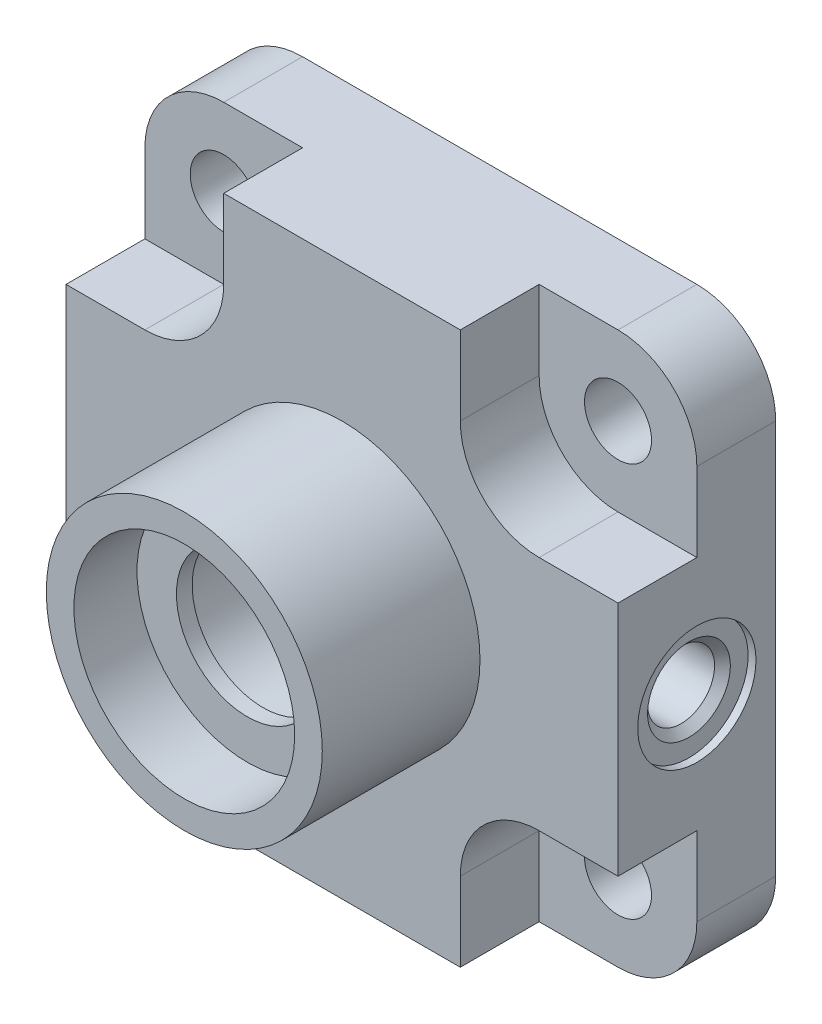
from build123d import *

# Parameters (mm, degrees)
SKETCH2_W               = 70
SKETCH2_H               = 70
BOSS_EXTRUDE1_DEPTH     = 24
SKETCH3_R               = 55
SKETCH3_W               = 70
SKETCH3_H               = 70
SKETCH3_R_2             = 22
SKETCH3_R_3             = 16
CUT_EXTRUDE1_DEPTH      = 4
SKETCH3_3_W             = 70
SKETCH3_3_H             = 70
SKETCH3_3_R             = 25
CUT_EXTRUDE2_DEPTH      = 4
SKETCH4_W               = 20
SKETCH4_H               = 20
SKETCH4_R               = 4.25
CUT_EXTRUDE3_DEPTH      = 10
CUT_EXTRUDE4_REACH      = 57.009
SKETCH4_3_R             = 4.25
MIRROR2_COPY_1_SKETCH_W = 20
MIRROR2_COPY_1_SKETCH_H = 20
MIRROR2_COPY_1_SKETCH_R = 4.25
MIRROR2_COPY_1_DEPTH    = 10
MIRROR2_COPY_2_REACH    = 57.009
MIRROR2_COPY_2_SKETCH_R = 4.25
FILLET1_R               = 10
SKETCH5_R               = 17.5
BOSS_EXTRUDE2_DEPTH     = 20
SKETCH6_R               = 14
CUT_EXTRUDE5_DEPTH      = 8
SKETCH7_R               = 9
CUT_EXTRUDE6_DEPTH      = 2
SKETCH8_R               = 10
CUT_EXTRUDE7_DEPTH      = 10
SKETCH9_R               = 9
CUT_EXTRUDE8_DEPTH      = 4
SKETCH10_R              = 10
CUT_EXTRUDE9_DEPTH      = 20
SKETCH11_R              = 7.5
CUT_EXTRUDE10_DEPTH     = 1
M10_TAPPED_HOLE1_REACH  = 91.006
M10_TAPPED_HOLE1_BORE_R = 4.25
CHAMFER1_SIZE           = 1


with BuildPart() as part:
    # Sketch2 → Boss-Extrude1 (new body)
    with BuildSketch(Plane.XY):
        Rectangle(SKETCH2_W, SKETCH2_H)
    extrude(amount=BOSS_EXTRUDE1_DEPTH)

    # Sketch3 → Cut-Extrude1 (cut)
    # profile 1 of 2: a face of its own
    with BuildSketch(Plane(origin=(0, 0, 0), x_dir=(-1, 0, 0), z_dir=(0, 0, -1))):
        Circle(SKETCH3_R)
        Rectangle(SKETCH3_W, SKETCH3_H, mode=Mode.SUBTRACT)
    # profile 2 of 2: a face of its own
    with BuildSketch(Plane(origin=(0, 0, 0), x_dir=(-1, 0, 0), z_dir=(0, 0, -1))):
        Circle(SKETCH3_R_2)
        Circle(SKETCH3_R_3, mode=Mode.SUBTRACT)
    extrude(amount=-CUT_EXTRUDE1_DEPTH, mode=Mode.SUBTRACT)

    # Sketch3<3> → Cut-Extrude2 (cut)
    with BuildSketch(Plane(origin=(0, 0, 0), x_dir=(-1, 0, 0), z_dir=(0, 0, -1))):
        Rectangle(SKETCH3_3_W, SKETCH3_3_H)
        Circle(SKETCH3_3_R, mode=Mode.SUBTRACT)
    extrude(amount=-CUT_EXTRUDE2_DEPTH, mode=Mode.SUBTRACT)

    # Sketch4 → Cut-Extrude3 (cut)
    with BuildSketch(Plane.XY.offset(24)):
        with Locations((-25, 25)):
            Rectangle(SKETCH4_W, SKETCH4_H)
        with Locations((-25, 25)):
            Circle(SKETCH4_R, mode=Mode.SUBTRACT)
    cut_extrude3 = extrude(amount=-CUT_EXTRUDE3_DEPTH, mode=Mode.SUBTRACT)

    # Sketch4<3> → Cut-Extrude4 (cut, up to next)
    with BuildSketch(Plane.XY.offset(24), mode=Mode.PRIVATE) as cut_extrude4_sk1:
        with Locations((-25, 25)):
            Circle(SKETCH4_3_R)
    cut_extrude4_tool1 = extrude(cut_extrude4_sk1.sketch, amount=-CUT_EXTRUDE4_REACH, mode=Mode.PRIVATE) & part.part
    cut_extrude4 = cut_extrude4_tool1.solids().sort_by_distance((-25, 25, 24))[0]
    add(cut_extrude4, mode=Mode.SUBTRACT)

    # Mirror1: Cut-Extrude3, Cut-Extrude4 across plane
    add(cut_extrude3.mirror(Plane.ZX), mode=Mode.SUBTRACT)
    add(cut_extrude4.mirror(Plane.ZX), mode=Mode.SUBTRACT)

    # Mirror2: Cut-Extrude3, Cut-Extrude4 across plane
    add(cut_extrude3.mirror(Plane(origin=(0, 0, 0), x_dir=(0, 0, 1), z_dir=(1, 0, 0))), mode=Mode.SUBTRACT)
    add(cut_extrude4.mirror(Plane(origin=(0, 0, 0), x_dir=(0, 0, 1), z_dir=(1, 0, 0))), mode=Mode.SUBTRACT)

    # Mirror2 copy 1 sketch → Mirror2 copy 1 (cut)
    with BuildSketch(Plane(origin=(0, 0, 24), x_dir=(-1, 0, 0), z_dir=(0, 0, 1))):
        with Locations((-25, 25)):
            Rectangle(MIRROR2_COPY_1_SKETCH_W, MIRROR2_COPY_1_SKETCH_H)
        with Locations((-25, 25)):
            Circle(MIRROR2_COPY_1_SKETCH_R, mode=Mode.SUBTRACT)
    extrude(amount=-MIRROR2_COPY_1_DEPTH, mode=Mode.SUBTRACT)

    # Mirror2 copy 2 sketch → Mirror2 copy 2 (cut, up to next)
    with BuildSketch(Plane(origin=(0, 0, 24), x_dir=(-1, 0, 0), z_dir=(0, 0, 1)), mode=Mode.PRIVATE) as mirror2_copy_2_sk1:
        with Locations((-25, 25)):
            Circle(MIRROR2_COPY_2_SKETCH_R)
    mirror2_copy_2_tool1 = extrude(mirror2_copy_2_sk1.sketch, amount=-MIRROR2_COPY_2_REACH, mode=Mode.PRIVATE) & part.part
    add(mirror2_copy_2_tool1.solids().sort_by_distance((25, -25, 24))[0], mode=Mode.SUBTRACT)

    # Fillet1
    fillet1_edges = [part.edges().sort_by_distance(p)[0] for p in [
        (35, -35, 9),
        (15, -15, 19),
        (-35, 35, 9),
        (-15, 15, 19),
        (-35, -35, 9),
        (-15, -15, 19),
        (35, 35, 9),
        (15, 15, 19),
    ]]
    fillet(fillet1_edges, radius=FILLET1_R)

    # Sketch5 → Boss-Extrude2 (add)
    with BuildSketch(Plane.XY.offset(24)):
        Circle(SKETCH5_R)
    extrude(amount=BOSS_EXTRUDE2_DEPTH)

    # Sketch6 → Cut-Extrude5 (cut)
    with BuildSketch(Plane.XY.offset(44)):
        Circle(SKETCH6_R)
    extrude(amount=-CUT_EXTRUDE5_DEPTH, mode=Mode.SUBTRACT)

    # Sketch7 → Cut-Extrude6 (cut)
    with BuildSketch(Plane.XY.offset(36)):
        Circle(SKETCH7_R)
    extrude(amount=-CUT_EXTRUDE6_DEPTH, mode=Mode.SUBTRACT)

    # Sketch8 → Cut-Extrude7 (cut)
    with BuildSketch(Plane.XY.offset(34)):
        Circle(SKETCH8_R)
    extrude(amount=-CUT_EXTRUDE7_DEPTH, mode=Mode.SUBTRACT)

    # Sketch9 → Cut-Extrude8 (cut)
    with BuildSketch(Plane.XY.offset(24)):
        Circle(SKETCH9_R)
    extrude(amount=-CUT_EXTRUDE8_DEPTH, mode=Mode.SUBTRACT)

    # Sketch10 → Cut-Extrude9 (cut)
    with BuildSketch(Plane.XY.offset(20)):
        Circle(SKETCH10_R)
    extrude(amount=-CUT_EXTRUDE9_DEPTH, mode=Mode.SUBTRACT)

    # Sketch11 → Cut-Extrude10 (cut)
    with BuildSketch(Plane(origin=(35, 0, 0), x_dir=(0, 0, -1), z_dir=(1, 0, 0))):
        with Locations((-14, 0)):
            Circle(SKETCH11_R)
    extrude(amount=-CUT_EXTRUDE10_DEPTH, mode=Mode.SUBTRACT)

    # M10 Tapped Hole1 bore → M10 Tapped Hole1 (cut, up to next)
    with BuildSketch(Plane(origin=(34, 0, 0), x_dir=(0, 0, -1), z_dir=(1, 0, 0)), mode=Mode.PRIVATE) as m10_tapped_hole1_sk1:
        with Locations((-14, 0)):
            Circle(M10_TAPPED_HOLE1_BORE_R)
    m10_tapped_hole1_tool1 = extrude(m10_tapped_hole1_sk1.sketch, amount=-M10_TAPPED_HOLE1_REACH, mode=Mode.PRIVATE) & part.part
    add(m10_tapped_hole1_tool1.solids().sort_by_distance((34, 0, 14))[0], mode=Mode.SUBTRACT)

    # Chamfer1
    chamfer1_edges = [part.edges().sort_by_distance(p)[0] for p in [
        (34, 0, 18.25),
    ]]
    chamfer(chamfer1_edges, length=CHAMFER1_SIZE)


solid = part.part
